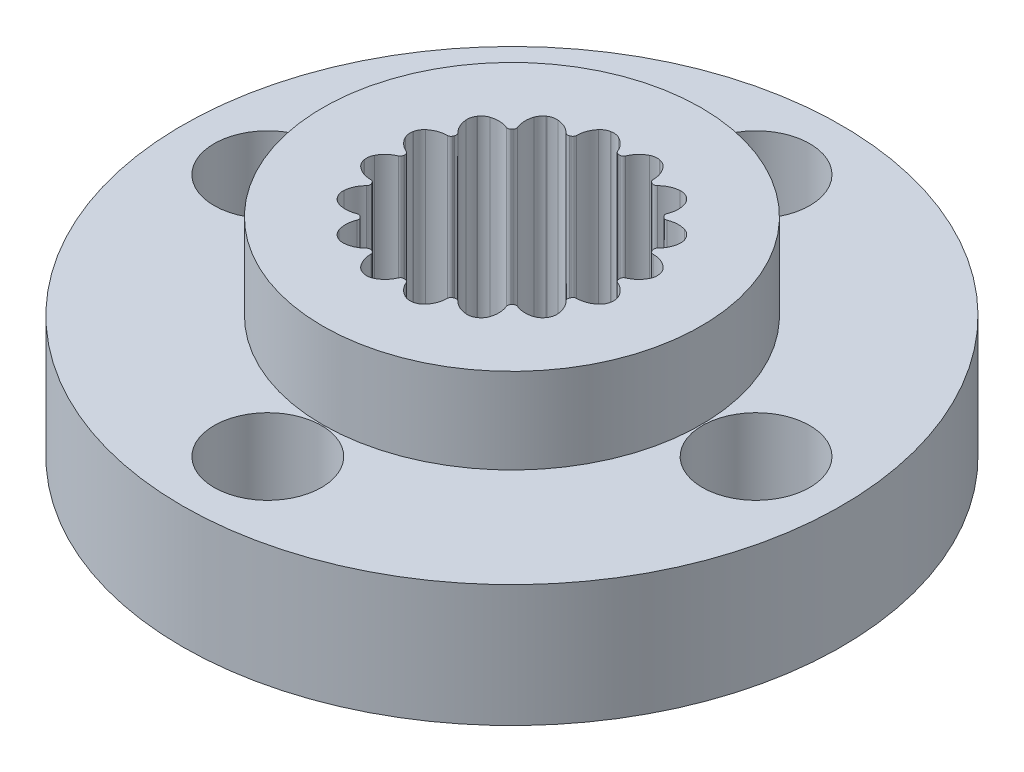
from build123d import *

# Parameters (mm, degrees)
SKETCH3_R                                           = 13.5
SKETCH3_R_2                                         = 1.25
BOSS_EXTRUDE1_DEPTH                                 = 8.5
SKETCH4_R                                           = 5.15
CUT_EXTRUDE1_DEPTH                                  = 21.898564544
BOSS_EXTRUDE2_DEPTH                                 = 8.5
CIRPATTERN5_COUNT                                   = 16
SKETCH6_R                                           = 2.25
SKETCH6_R_2                                         = 1.25
BOSS_EXTRUDE3_DEPTH                                 = 0.5
SKETCH7_R                                           = 13.5
SKETCH7_R_2                                         = 7.75
CUT_EXTRUDE2_DEPTH                                  = 3.5
CBORE_FOR_M2_HEX_SOCKET_HEAD_CAP_SCREW1_D           = 2.4
CBORE_FOR_M2_HEX_SOCKET_HEAD_CAP_SCREW1_DEPTH       = 10
CBORE_FOR_M2_HEX_SOCKET_HEAD_CAP_SCREW1_CBORE_D     = 4.4
CBORE_FOR_M2_HEX_SOCKET_HEAD_CAP_SCREW1_CBORE_DEPTH = 3.2
CBORE_FOR_M2_HEX_SOCKET_HEAD_CAP_SCREW1_TIP         = 0.721032743


with BuildPart() as part:
    # Sketch3 → Boss-Extrude1 (new body)
    with BuildSketch(Plane(origin=(0, 0, 0), x_dir=(1, 0, 0), z_dir=(0, 1, 0))):
        with Locations(Location((0, 0, 0), (0, 0, 270))):
            Circle(SKETCH3_R)
        with Locations(Location((0, -10, 0), (0, 0, 270))):
            Circle(SKETCH3_R_2, mode=Mode.SUBTRACT)
        with Locations(Location((10, 0, 0), (0, 0, 270))):
            Circle(SKETCH3_R_2, mode=Mode.SUBTRACT)
        with Locations(Location((0, 10, 0), (0, 0, 270))):
            Circle(SKETCH3_R_2, mode=Mode.SUBTRACT)
        with Locations(Location((-10, 0, 0), (0, 0, 270))):
            Circle(SKETCH3_R_2, mode=Mode.SUBTRACT)
    extrude(amount=BOSS_EXTRUDE1_DEPTH)

    # Sketch4 → Cut-Extrude1 (cut, through all)
    with BuildSketch(Plane(origin=(0, 8.5, 0), x_dir=(1, 0, 0), z_dir=(0, 1, 0))):
        with Locations(Location((0, 0, 0), (0, 0, 270))):
            Circle(SKETCH4_R)
    extrude(amount=-CUT_EXTRUDE1_DEPTH, mode=Mode.SUBTRACT)


with BuildPart() as body_2:
    # Sketch5 → Boss-Extrude2 (new body)
    with BuildSketch(Plane(origin=(0, 8.5, 0), x_dir=(1, 0, 0), z_dir=(0, 1, 0))):
        with BuildLine():
            Line((-0.025, -4.4), (0.025, -4.4))
            ThreePointArc((0.025, -4.4), (0.108456141, -4.425360229), (0.163692724, -4.4928657))
            ThreePointArc((0.163692724, -4.4928657), (0.353632832, -4.790386284), (0.635110698, -5.003379133))
            ThreePointArc((0.635110698, -5.003379133), (0.81024092, -5.058364166), (0.993727863, -5.053217285))
            ThreePointArc((0.993727863, -5.053217285), (0, -5.15), (-0.993727863, -5.053217285))
            ThreePointArc((-0.993727863, -5.053217285), (-0.81024092, -5.058364166), (-0.635110698, -5.003379133))
            ThreePointArc((-0.635110698, -5.003379133), (-0.353632832, -4.790386284), (-0.163692724, -4.4928657))
            ThreePointArc((-0.163692724, -4.4928657), (-0.108456141, -4.425360229), (-0.025, -4.4))
        make_face()
    extrude(amount=-BOSS_EXTRUDE2_DEPTH)


with BuildPart() as cirpattern5_1:
    # CirPattern5: pattern copy
    add(body_2.part.rotate(Axis((0, 0, 0), (0, 1, 0)), 1 * 360 / CIRPATTERN5_COUNT))


with BuildPart() as cirpattern5_2:
    # CirPattern5: pattern copy
    add(body_2.part.rotate(Axis((0, 0, 0), (0, 1, 0)), 2 * 360 / CIRPATTERN5_COUNT))


with BuildPart() as cirpattern5_3:
    # CirPattern5: pattern copy
    add(body_2.part.rotate(Axis((0, 0, 0), (0, 1, 0)), 3 * 360 / CIRPATTERN5_COUNT))


with BuildPart() as cirpattern5_4:
    # CirPattern5: pattern copy
    add(body_2.part.rotate(Axis((0, 0, 0), (0, 1, 0)), 4 * 360 / CIRPATTERN5_COUNT))


with BuildPart() as cirpattern5_5:
    # CirPattern5: pattern copy
    add(body_2.part.rotate(Axis((0, 0, 0), (0, 1, 0)), 5 * 360 / CIRPATTERN5_COUNT))


with BuildPart() as cirpattern5_6:
    # CirPattern5: pattern copy
    add(body_2.part.rotate(Axis((0, 0, 0), (0, 1, 0)), 6 * 360 / CIRPATTERN5_COUNT))


with BuildPart() as cirpattern5_7:
    # CirPattern5: pattern copy
    add(body_2.part.rotate(Axis((0, 0, 0), (0, 1, 0)), 7 * 360 / CIRPATTERN5_COUNT))


with BuildPart() as cirpattern5_8:
    # CirPattern5: pattern copy
    add(body_2.part.rotate(Axis((0, 0, 0), (0, 1, 0)), 8 * 360 / CIRPATTERN5_COUNT))


with BuildPart() as cirpattern5_9:
    # CirPattern5: pattern copy
    add(body_2.part.rotate(Axis((0, 0, 0), (0, 1, 0)), 9 * 360 / CIRPATTERN5_COUNT))


with BuildPart() as cirpattern5_10:
    # CirPattern5: pattern copy
    add(body_2.part.rotate(Axis((0, 0, 0), (0, 1, 0)), 10 * 360 / CIRPATTERN5_COUNT))


with BuildPart() as cirpattern5_11:
    # CirPattern5: pattern copy
    add(body_2.part.rotate(Axis((0, 0, 0), (0, 1, 0)), 11 * 360 / CIRPATTERN5_COUNT))


with BuildPart() as cirpattern5_12:
    # CirPattern5: pattern copy
    add(body_2.part.rotate(Axis((0, 0, 0), (0, 1, 0)), 12 * 360 / CIRPATTERN5_COUNT))


with BuildPart() as cirpattern5_13:
    # CirPattern5: pattern copy
    add(body_2.part.rotate(Axis((0, 0, 0), (0, 1, 0)), 13 * 360 / CIRPATTERN5_COUNT))


with BuildPart() as cirpattern5_14:
    # CirPattern5: pattern copy
    add(body_2.part.rotate(Axis((0, 0, 0), (0, 1, 0)), 14 * 360 / CIRPATTERN5_COUNT))


with BuildPart() as cirpattern5_15:
    # CirPattern5: pattern copy
    add(body_2.part.rotate(Axis((0, 0, 0), (0, 1, 0)), 15 * 360 / CIRPATTERN5_COUNT))


with BuildPart() as cirpattern5_1_1:
    add(cirpattern5_1.part)

    # Combine2: union CirPattern5_2, CirPattern5_3, CirPattern5_4, CirPattern5_5, CirPattern5_6, CirPattern5_7, CirPattern5_8, CirPattern5_9, CirPattern5_10, CirPattern5_11, CirPattern5_12, CirPattern5_13, CirPattern5_14, CirPattern5_15, body 2, part
    add(cirpattern5_2.part)
    add(cirpattern5_3.part)
    add(cirpattern5_4.part)
    add(cirpattern5_5.part)
    add(cirpattern5_6.part)
    add(cirpattern5_7.part)
    add(cirpattern5_8.part)
    add(cirpattern5_9.part)
    add(cirpattern5_10.part)
    add(cirpattern5_11.part)
    add(cirpattern5_12.part)
    add(cirpattern5_13.part)
    add(cirpattern5_14.part)
    add(cirpattern5_15.part)
    add(body_2.part)
    add(part.part)

    # Sketch6 → Boss-Extrude3 (add)
    # profile 1 of 4: a face of its own
    with BuildSketch(Plane.XZ):
        with Locations(Location((0, 10, 0), (0, 0, 90))):
            Circle(SKETCH6_R)
        with Locations(Location((0, 10, 0), (0, 0, 270))):
            Circle(SKETCH6_R_2, mode=Mode.SUBTRACT)
    # profile 2 of 4: a face of its own
    with BuildSketch(Plane.XZ):
        with Locations(Location((-10, 0, 0), (0, 0, 90))):
            Circle(SKETCH6_R)
        with Locations(Location((-10, 0, 0), (0, 0, 270))):
            Circle(SKETCH6_R_2, mode=Mode.SUBTRACT)
    # profile 3 of 4: a face of its own
    with BuildSketch(Plane.XZ):
        with Locations(Location((0, -10, 0), (0, 0, 90))):
            Circle(SKETCH6_R)
        with Locations(Location((0, -10, 0), (0, 0, 270))):
            Circle(SKETCH6_R_2, mode=Mode.SUBTRACT)
    # profile 4 of 4: a face of its own
    with BuildSketch(Plane.XZ):
        with Locations(Location((10, 0, 0), (0, 0, 90))):
            Circle(SKETCH6_R)
        with Locations(Location((10, 0, 0), (0, 0, 270))):
            Circle(SKETCH6_R_2, mode=Mode.SUBTRACT)
    extrude(amount=BOSS_EXTRUDE3_DEPTH)

    # Sketch7 → Cut-Extrude2 (cut)
    with BuildSketch(Plane(origin=(0, 8.5, 0), x_dir=(1, 0, 0), z_dir=(0, 1, 0))):
        with Locations(Location((0, 0, 0), (0, 0, 270))):
            Circle(SKETCH7_R)
        with Locations(Location((0, 0, 0), (0, 0, 270))):
            Circle(SKETCH7_R_2, mode=Mode.SUBTRACT)
    extrude(amount=-CUT_EXTRUDE2_DEPTH, mode=Mode.SUBTRACT)

    # CBORE for M2 Hex Socket Head Cap Screw1
    with Locations(Plane(origin=(0, 5, 0), x_dir=(1, 0, 0), z_dir=(0, 1, 0))):
        with Locations((0, 10), (10, 0), (0, -10), (-10, 0)):
            CounterBoreHole(CBORE_FOR_M2_HEX_SOCKET_HEAD_CAP_SCREW1_D / 2, CBORE_FOR_M2_HEX_SOCKET_HEAD_CAP_SCREW1_CBORE_D / 2, CBORE_FOR_M2_HEX_SOCKET_HEAD_CAP_SCREW1_CBORE_DEPTH, depth=CBORE_FOR_M2_HEX_SOCKET_HEAD_CAP_SCREW1_DEPTH)
            with Locations((0, 0, -(CBORE_FOR_M2_HEX_SOCKET_HEAD_CAP_SCREW1_DEPTH + CBORE_FOR_M2_HEX_SOCKET_HEAD_CAP_SCREW1_TIP / 2))):  # 118° drill point
                Cone(0, CBORE_FOR_M2_HEX_SOCKET_HEAD_CAP_SCREW1_D / 2, CBORE_FOR_M2_HEX_SOCKET_HEAD_CAP_SCREW1_TIP, mode=Mode.SUBTRACT)


solid = cirpattern5_1_1.part
